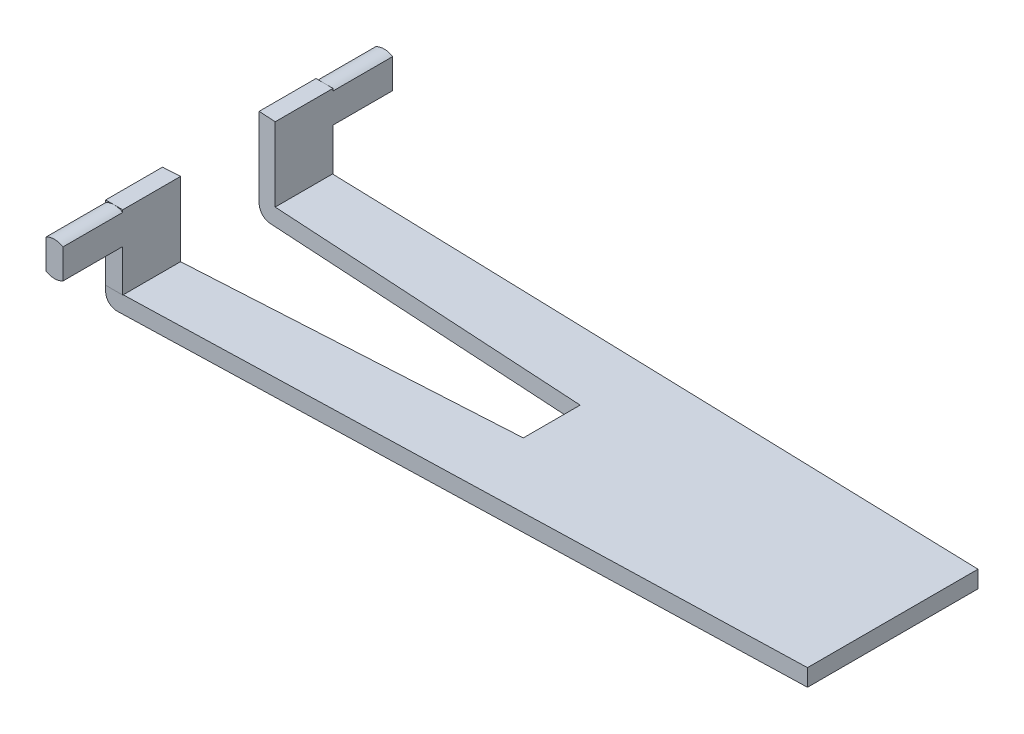
from build123d import *

# Parameters (mm, degrees)
BOSS_EXTRUDE1_DEPTH = 0.3
BOSS_EXTRUDE2_DEPTH = 1.3
SKETCH3_W           = 1.05
SKETCH3_H           = 0.7
CUT_EXTRUDE1_DEPTH  = 0.3
FILLET1_R           = 0.2
SKETCH4_OUTSIDE_W   = 16.684
SKETCH4_OUTSIDE_H   = 6.284
CUT_EXTRUDE3_DEPTH  = 1.05
SKETCH5_OUTSIDE_W   = 16.684
SKETCH5_OUTSIDE_H   = 6.284
CUT_EXTRUDE4_DEPTH  = 1.05


with BuildPart() as part:
    # Sketch1 → Boss-Extrude1 (new body)
    with BuildSketch(Plane(origin=(0, 0, 0), x_dir=(1, 0, 0), z_dir=(0, 1, 0))):
        Polygon((-6, 1.85236673), (6, 1.5), (6, -1.5), (-6, -1.84763327), (-6, -0.84763327), (0, -0.5), (0, 0.5), (-6, 0.85236673), align=None)
    extrude(amount=BOSS_EXTRUDE1_DEPTH)

    # Sketch2 → Boss-Extrude2 (add)
    with BuildSketch(Plane(origin=(0, 0.3, 0), x_dir=(1, 0, 0), z_dir=(0, 1, 0))):
        Polygon((-6, 0.85236673), (-6, 2.90236673), (-5.7, 2.90236673), (-5.7, 0.834748394), align=None)
        Polygon((-6, -0.84763327), (-6, -2.89763327), (-5.7, -2.89763327), (-5.7, -0.830251606), align=None)
    extrude(amount=BOSS_EXTRUDE2_DEPTH)

    # Sketch3 → Cut-Extrude1 (cut)
    with BuildSketch(Plane.ZY.offset(6)):
        with Locations((-2.37736673, 0.65)):
            Rectangle(SKETCH3_W, SKETCH3_H)
        with Locations((2.37263327, 0.65)):
            Rectangle(SKETCH3_W, SKETCH3_H)
    extrude(amount=-CUT_EXTRUDE1_DEPTH, mode=Mode.SUBTRACT)

    # Fillet1
    fillet1_edges = [part.edges().sort_by_distance(p)[0] for p in [
        (-6, 0, -1.35236673),
        (-6, 0, 1.34763327),
    ]]
    fillet(fillet1_edges, radius=FILLET1_R)

    # Sketch4 outside → Cut-Extrude3 (cut)
    with BuildSketch(Plane(origin=(0, 0, -2.90236673), x_dir=(-1, 0, 0), z_dir=(0, 0, -1))):
        with Locations((0, 0.8)):
            Rectangle(SKETCH4_OUTSIDE_W, SKETCH4_OUTSIDE_H)
        with BuildLine():
            Line((5.7, 1.559807621), (5.7, 1.040192379))
            ThreePointArc((5.7, 1.040192379), (5.85, 1), (6, 1.040192379))
            Line((6, 1.040192379), (6, 1.559807621))
            ThreePointArc((6, 1.559807621), (5.85, 1.6), (5.7, 1.559807621))
        make_face(mode=Mode.SUBTRACT)
    extrude(amount=-CUT_EXTRUDE3_DEPTH, mode=Mode.SUBTRACT)

    # Sketch5 outside → Cut-Extrude4 (cut)
    with BuildSketch(Plane.XY.offset(2.89763327)):
        with Locations((0, 0.8)):
            Rectangle(SKETCH5_OUTSIDE_W, SKETCH5_OUTSIDE_H)
        with BuildLine():
            Line((-5.7, 1.559807621), (-5.7, 1.040192379))
            ThreePointArc((-5.7, 1.040192379), (-5.85, 1), (-6, 1.040192379))
            Line((-6, 1.040192379), (-6, 1.559807621))
            ThreePointArc((-6, 1.559807621), (-5.85, 1.6), (-5.7, 1.559807621))
        make_face(mode=Mode.SUBTRACT)
    extrude(amount=-CUT_EXTRUDE4_DEPTH, mode=Mode.SUBTRACT)


solid = part.part
